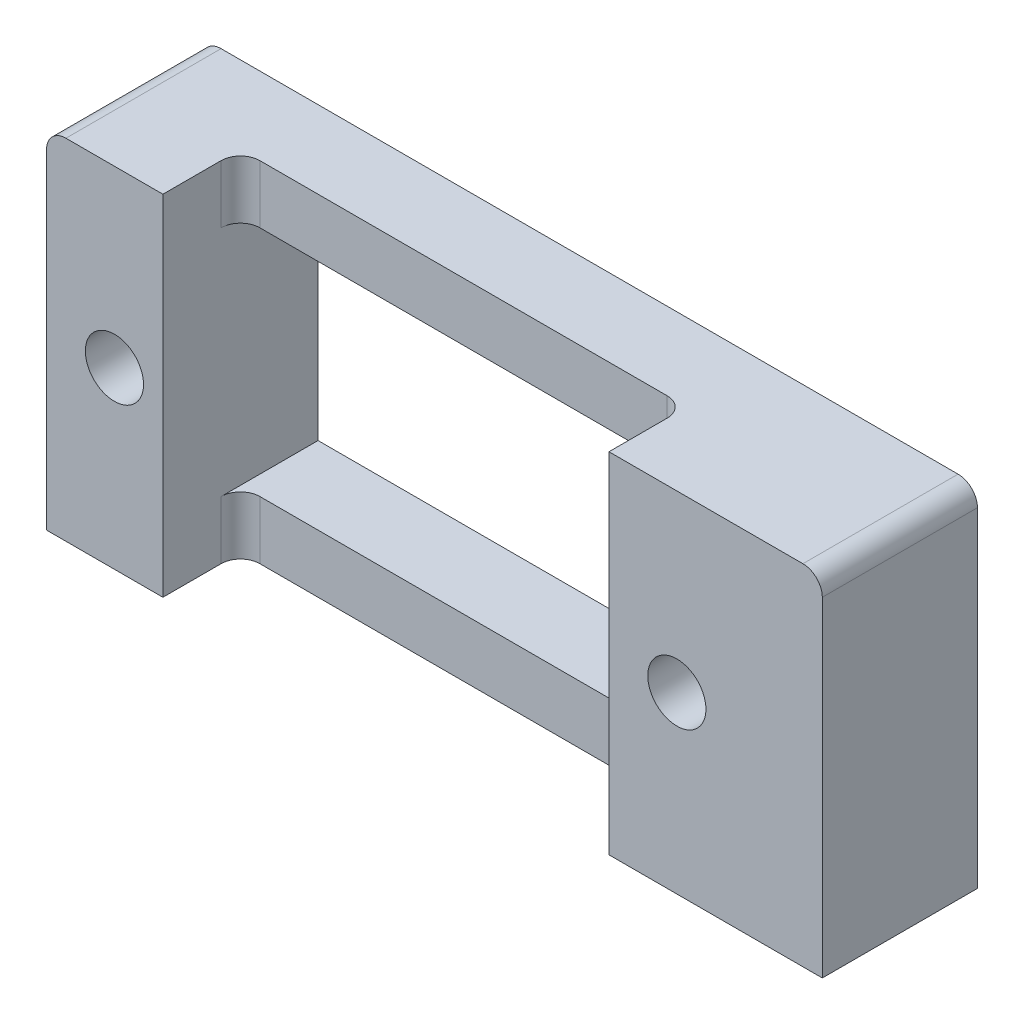
from build123d import *

# Parameters (mm, degrees)
BOSS_EXTRUDE1_DEPTH = 8
SKETCH2_W           = 23
SKETCH2_H           = 3
CUT_EXTRUDE1_DEPTH  = 4
FILLET1_R           = 1
FILLET2_R           = 1


with BuildPart() as part:
    # Sketch1 → Boss-Extrude1 (new body)
    with BuildSketch(Plane.XY):
        with BuildLine():
            ThreePointArc((15.076086957, 0.60326087), (16.576086957, 2.10326087), (18.076086957, 0.60326087))
            Line((18.076086957, 0.60326087), (24.076086957, 0.60326087))
            Line((24.076086957, 0.60326087), (24.076086957, 6.60326087))
            Line((24.076086957, 6.60326087), (24.076086957, 9.60326087))
            Line((24.076086957, 9.60326087), (13.076086957, 9.60326087))
            Line((13.076086957, 9.60326087), (-9.923913043, 9.60326087))
            Line((-9.923913043, 9.60326087), (-15.923913043, 9.60326087))
            Line((-15.923913043, 9.60326087), (-15.923913043, 6.60326087))
            Line((-15.923913043, 6.60326087), (-15.923913043, 0.60326087))
            Line((-15.923913043, 0.60326087), (-13.923913043, 0.60326087))
            ThreePointArc((-13.923913043, 0.60326087), (-12.423913043, 2.10326087), (-10.923913043, 0.60326087))
            Line((-10.923913043, 0.60326087), (-9.923913043, 0.60326087))
            Line((-9.923913043, 0.60326087), (-9.923913043, 6.60326087))
            Line((-9.923913043, 6.60326087), (13.076086957, 6.60326087))
            Line((13.076086957, 6.60326087), (13.076086957, 0.60326087))
            Line((13.076086957, 0.60326087), (15.076086957, 0.60326087))
        make_face()
        with BuildLine():
            Line((24.076086957, 0.60326087), (18.076086957, 0.60326087))
            ThreePointArc((18.076086957, 0.60326087), (16.576086957, -0.89673913), (15.076086957, 0.60326087))
            Line((15.076086957, 0.60326087), (13.076086957, 0.60326087))
            Line((13.076086957, 0.60326087), (13.076086957, -5.39673913))
            Line((13.076086957, -5.39673913), (-9.923913043, -5.39673913))
            Line((-9.923913043, -5.39673913), (-9.923913043, 0.60326087))
            Line((-9.923913043, 0.60326087), (-10.923913043, 0.60326087))
            ThreePointArc((-10.923913043, 0.60326087), (-12.423913043, -0.89673913), (-13.923913043, 0.60326087))
            Line((-13.923913043, 0.60326087), (-15.923913043, 0.60326087))
            Line((-15.923913043, 0.60326087), (-15.923913043, -5.39673913))
            Line((-15.923913043, -5.39673913), (-15.923913043, -8.39673913))
            Line((-15.923913043, -8.39673913), (-9.923913043, -8.39673913))
            Line((-9.923913043, -8.39673913), (13.076086957, -8.39673913))
            Line((13.076086957, -8.39673913), (24.076086957, -8.39673913))
            Line((24.076086957, -8.39673913), (24.076086957, -5.39673913))
            Line((24.076086957, -5.39673913), (24.076086957, 0.60326087))
        make_face()
    extrude(amount=-BOSS_EXTRUDE1_DEPTH)

    # Sketch2 → Cut-Extrude1 (cut)
    with BuildSketch(Plane.XY):
        with Locations((1.576086957, 8.10326087)):
            Rectangle(SKETCH2_W, SKETCH2_H)
        with Locations((1.576086957, -6.89673913)):
            Rectangle(SKETCH2_W, SKETCH2_H)
    extrude(amount=-CUT_EXTRUDE1_DEPTH, mode=Mode.SUBTRACT)

    # Fillet1
    fillet1_edges = [part.edges().sort_by_distance(p)[0] for p in [
        (-9.923913043, 8.10326087, -4),
        (13.076086957, 8.10326087, -4),
        (-9.923913043, -6.89673913, -4),
        (13.076086957, -6.89673913, -4),
    ]]
    fillet(fillet1_edges, radius=FILLET1_R)

    # Fillet2
    fillet2_edges = [part.edges().sort_by_distance(p)[0] for p in [
        (-15.923913043, 9.60326087, -4),
        (24.076086957, 9.60326087, -4),
    ]]
    fillet(fillet2_edges, radius=FILLET2_R)


solid = part.part
